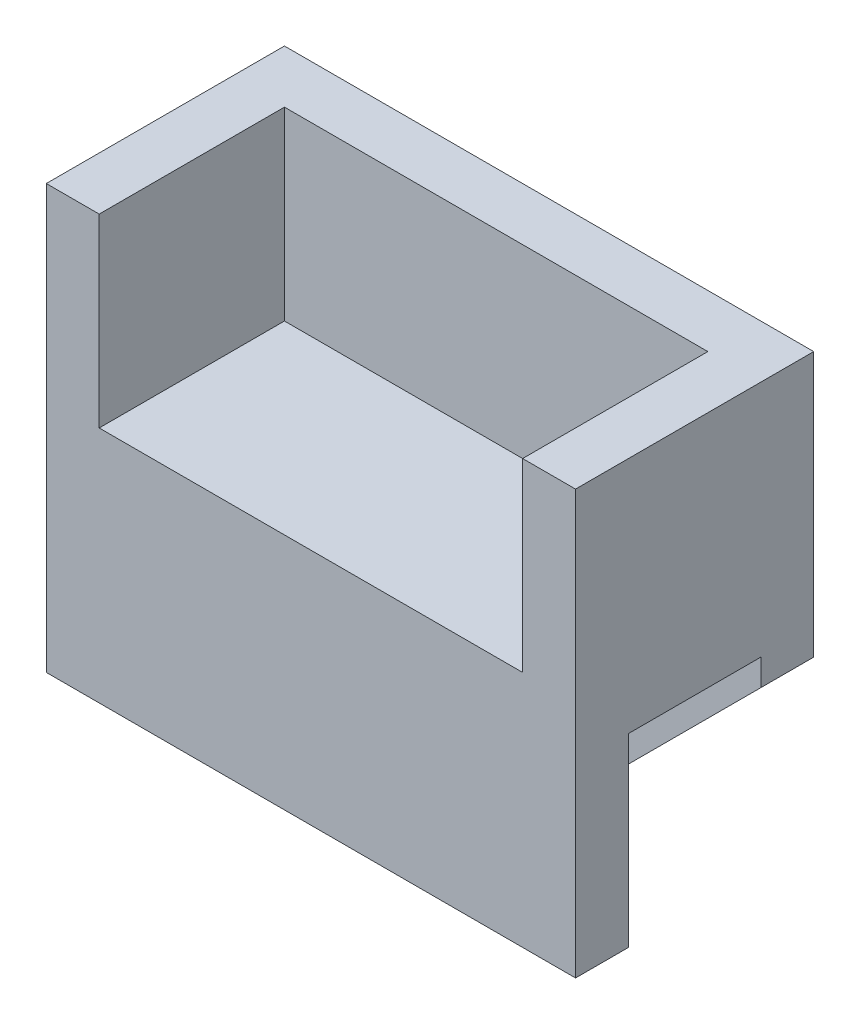
from build123d import *

# Parameters (mm, degrees)
BOSS_EXTRU_1_DEPTH      = 10
ESQUISSE2_W             = 100
ESQUISSE2_H             = 45
BOSS_EXTRU_2_DEPTH      = 35
ESQUISSE3_W             = 100
ESQUISSE3_H             = 10
BOSS_EXTRU_3_DEPTH      = 35
ESQUISSE5_R             = 10
BOSS_EXTRU_4_DEPTH      = 35
ESQUISSE4_W             = 80
ESQUISSE4_H             = 35
ENL_V_MAT_EXTRU_1_DEPTH = 35


with BuildPart() as part:
    # Esquisse1 → Boss.-Extru.1 (new body)
    with BuildSketch(Plane.XY):
        Polygon((0, 0), (-50, 50), (-50, 100), (50, 100), (50, 50), align=None)
    extrude(amount=BOSS_EXTRU_1_DEPTH)

    # Esquisse2 → Boss.-Extru.2 (add)
    with BuildSketch(Plane.XY.offset(10)):
        with Locations((0, 77.5)):
            Rectangle(ESQUISSE2_W, ESQUISSE2_H)
    extrude(amount=BOSS_EXTRU_2_DEPTH)

    # Esquisse3 → Boss.-Extru.3 (add)
    with BuildSketch(Plane.XZ.offset(-55)):
        with Locations((0, 40)):
            Rectangle(ESQUISSE3_W, ESQUISSE3_H)
    extrude(amount=BOSS_EXTRU_3_DEPTH)

    # Esquisse5 → Boss.-Extru.4 (add)
    with BuildSketch(Plane(origin=(0, 0, 35), x_dir=(-1, 0, 0), z_dir=(0, 0, -1))):
        with Locations((-37.5, 60)):
            Circle(ESQUISSE5_R)
        with Locations((37.5, 60)):
            Circle(ESQUISSE5_R)
    extrude(amount=BOSS_EXTRU_4_DEPTH)

    # Esquisse4 → Enlèv. mat.-Extru.1 (cut)
    with BuildSketch(Plane(origin=(0, 100, 0), x_dir=(1, 0, 0), z_dir=(0, 1, 0))):
        with Locations((0, -27.5)):
            Rectangle(ESQUISSE4_W, ESQUISSE4_H)
    extrude(amount=-ENL_V_MAT_EXTRU_1_DEPTH, mode=Mode.SUBTRACT)


solid = part.part
